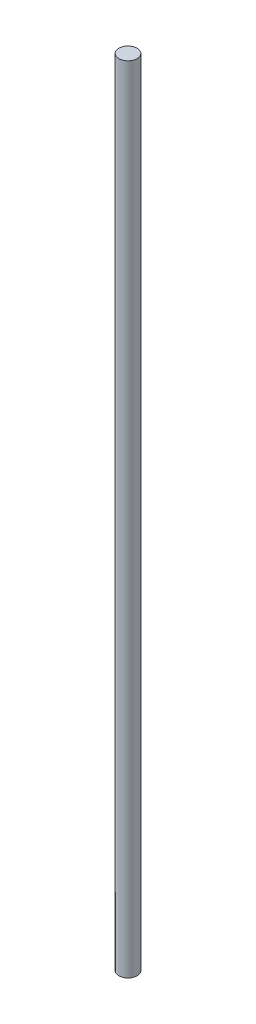
from build123d import *

# Parameters (mm, degrees)
SKETCH1_R           = 4
BOSS_EXTRUDE1_DEPTH = 350


with BuildPart() as part:
    # Sketch1 → Boss-Extrude1 (new body)
    with BuildSketch(Plane(origin=(0, 0, 0), x_dir=(1, 0, 0), z_dir=(0, 1, 0))):
        with Locations(Location((0, 0, 0), (0, 0, 270))):
            Circle(SKETCH1_R)
    extrude(amount=BOSS_EXTRUDE1_DEPTH)


solid = part.part
